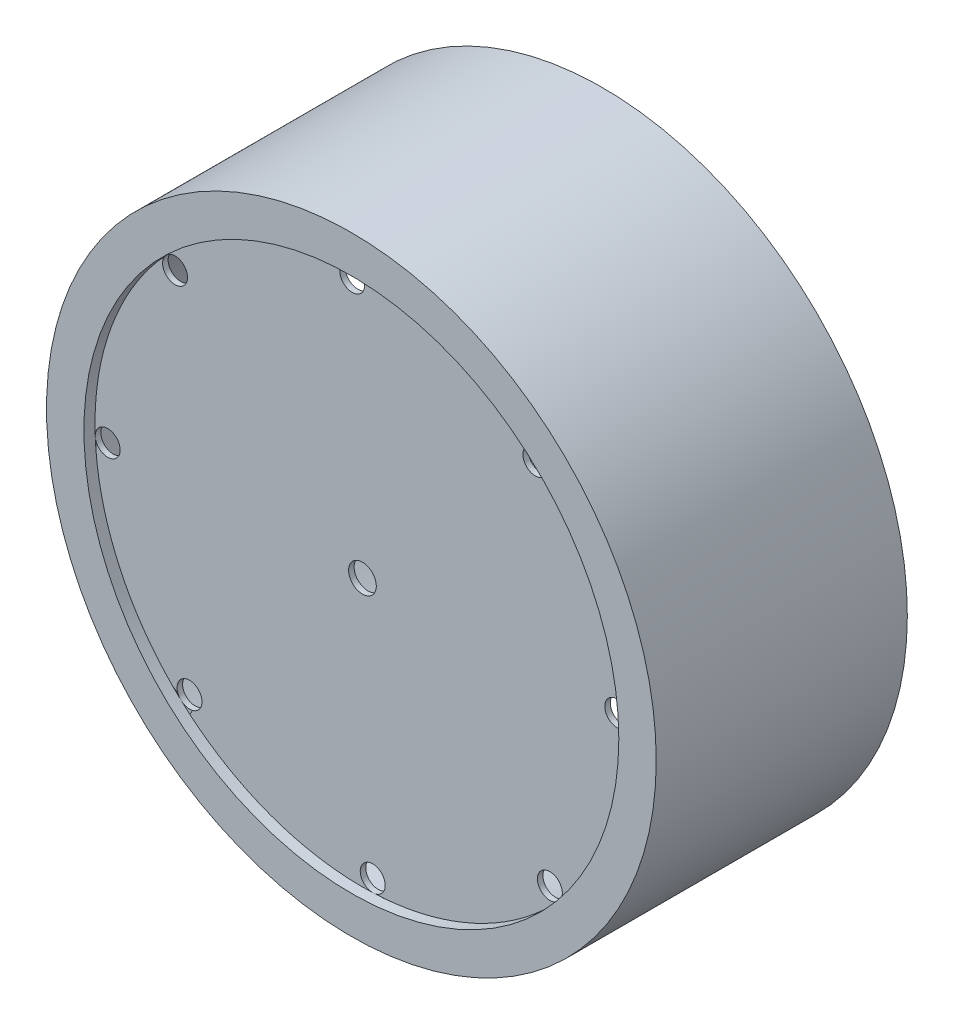
from build123d import *

# Parameters (mm, degrees)
SKETCH_1_R          = 55
EXTRUDE_3_DEPTH     = 45.3
SKETCH_5_R          = 50
CUT_EXTRUDE_3_DEPTH = 42.3
SKETCH_8_R          = 48.25
CUT_EXTRUDE_4_DEPTH = 2
SKETCH_6_R          = 2.25
CUT_EXTRUDE_6_DEPTH = 2
SKETCH_10_R         = 2.5
CUT_EXTRUDE_7_DEPTH = 5
EXTRUDE_9_DEPTH     = 15
EXTRUDE_10_DEPTH    = 15
SKETCH_20_R         = 2.5
CUT_EXTRUDE_9_DEPTH = 8


with BuildPart() as part:
    # 草图1 → 凸台-拉伸3 (new body)
    with BuildSketch(Plane.XY):
        Circle(SKETCH_1_R)
    extrude(amount=EXTRUDE_3_DEPTH)

    # 草图5 → 切除-拉伸3 (cut)
    with BuildSketch(Plane(origin=(0, 0, 0), x_dir=(-1, 0, 0), z_dir=(0, 0, -1))):
        Circle(SKETCH_5_R)
    extrude(amount=-CUT_EXTRUDE_3_DEPTH, mode=Mode.SUBTRACT)

    # 草图8 → 切除-拉伸4 (cut)
    with BuildSketch(Plane.XY.offset(45.3)):
        Circle(SKETCH_8_R)
    extrude(amount=-CUT_EXTRUDE_4_DEPTH, mode=Mode.SUBTRACT)

    # 草图6 → 切除-拉伸6 (cut)
    with BuildSketch(Plane(origin=(0, 0, 42.3), x_dir=(-1, 0, 0), z_dir=(0, 0, -1))):
        with Locations((31.194195936, -33.807131495)):
            Circle(SKETCH_6_R)
        with Locations((-1.847624453, -45.962879412)):
            Circle(SKETCH_6_R)
        with Locations((-33.807131495, -31.194195936)):
            Circle(SKETCH_6_R)
        with Locations((-45.962879412, 1.847624453)):
            Circle(SKETCH_6_R)
        with Locations((-31.194195936, 33.807131495)):
            Circle(SKETCH_6_R)
        with Locations((1.847624453, 45.962879412)):
            Circle(SKETCH_6_R)
        with Locations((33.807131495, 31.194195936)):
            Circle(SKETCH_6_R)
        with Locations((45.962879412, -1.847624453)):
            Circle(SKETCH_6_R)
    extrude(amount=-CUT_EXTRUDE_6_DEPTH, mode=Mode.SUBTRACT)

    # 草图10 → 切除-拉伸7 (cut)
    with BuildSketch(Plane(origin=(0, 0, 42.3), x_dir=(-1, 0, 0), z_dir=(0, 0, -1))):
        Circle(SKETCH_10_R)
    extrude(amount=-CUT_EXTRUDE_7_DEPTH, mode=Mode.SUBTRACT)

    # 草图18 → 凸台-拉伸9 (add)
    with BuildSketch(Plane(origin=(0, 0, 0), x_dir=(-1, 0, 0), z_dir=(0, 0, -1))):
        with BuildLine():
            ThreePointArc((53.188935765, -13.997753828), (53.054347717, -14.499523729), (52.915026221, -15))
            Line((52.915026221, -15), (82.832922753, -15))
            Line((82.832922753, -15), (82.832922753, -13.997753828))
            Line((82.832922753, -13.997753828), (53.188935765, -13.997753828))
        make_face()
    extrude(amount=-EXTRUDE_9_DEPTH)

    # 草图19 → 凸台-拉伸10 (add)
    with BuildSketch(Plane(origin=(0, 0, 0), x_dir=(-1, 0, 0), z_dir=(0, 0, -1))):
        Polygon((51.23475383, -20), (82.832922753, -20), (82.832922753, -20.999394473), (50.765297242, -20.999394473), (51.225275396, -20), align=None)
    extrude(amount=-EXTRUDE_10_DEPTH)

    # 草图20 → 切除-拉伸9 (cut)
    with BuildSketch(Plane(origin=(0, -20.999394473, 0), x_dir=(-1, 0, 0), z_dir=(0, -1, 0))):
        with Locations(Location((75.332922753, -7.5, 0), (0, 0, 90))):
            Circle(SKETCH_20_R)
    extrude(amount=-CUT_EXTRUDE_9_DEPTH, mode=Mode.SUBTRACT)


solid = part.part
